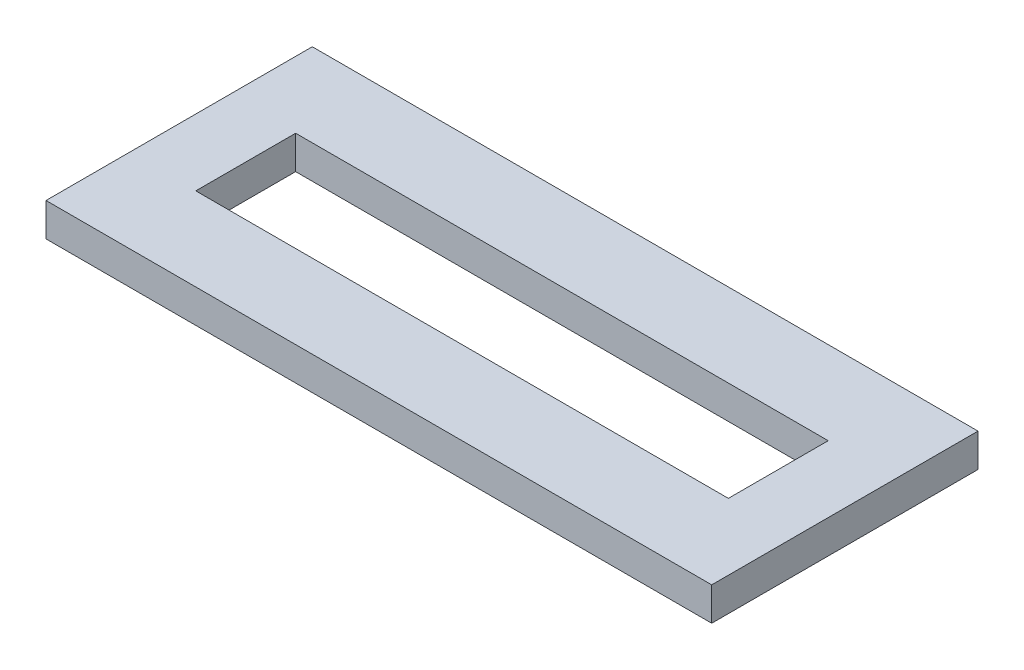
from build123d import *

# Parameters (mm, degrees)
SKETCH1_W           = 63.5
SKETCH1_H           = 25.4
SKETCH1_W_2         = 50.8
SKETCH1_H_2         = 9.525
BOSS_EXTRUDE1_DEPTH = 3.175


with BuildPart() as part:
    # Sketch1 → Boss-Extrude1 (new body)
    with BuildSketch(Plane(origin=(0, 0, 0), x_dir=(1, 0, 0), z_dir=(0, 1, 0))):
        Rectangle(SKETCH1_W, SKETCH1_H)
        Rectangle(SKETCH1_W_2, SKETCH1_H_2, mode=Mode.SUBTRACT)
    extrude(amount=BOSS_EXTRUDE1_DEPTH)


solid = part.part
